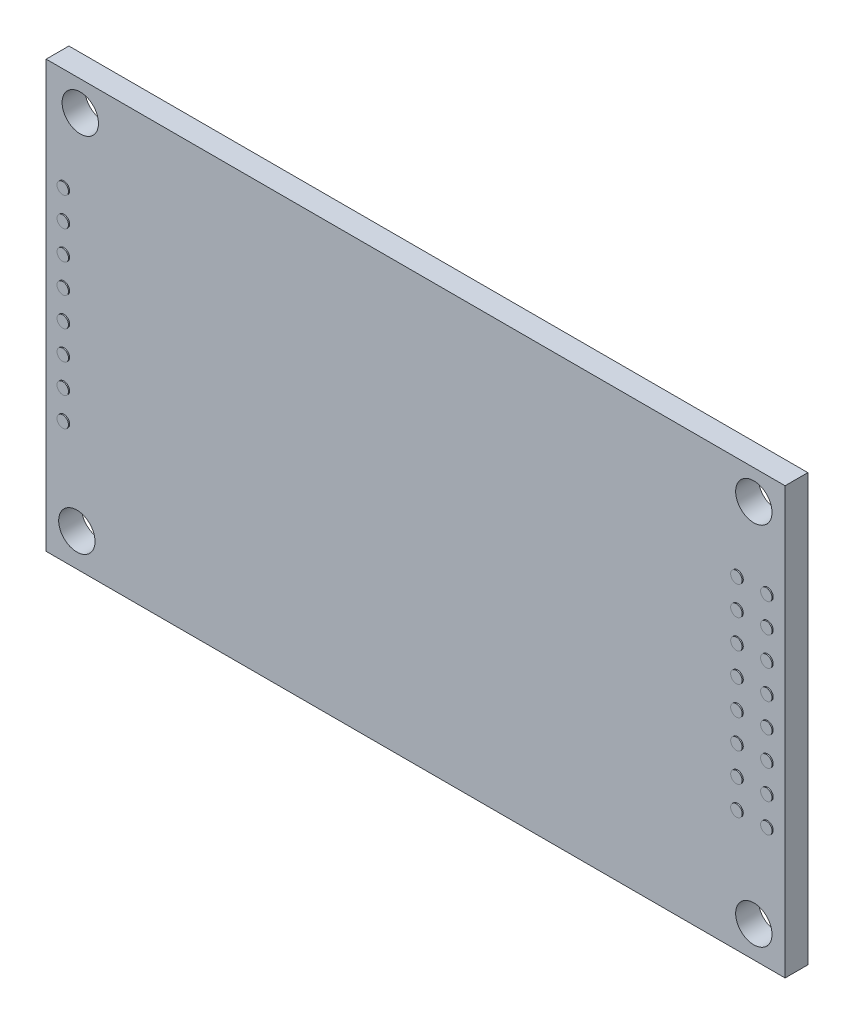
from build123d import *

# Parameters (mm, degrees)
SKETCH2_W               = 65
SKETCH2_H               = 37.5
SKETCH2_R               = 1.6
SKETCH2_R_2             = 0.201294772
BOSS_EXTRUDE1_DEPTH     = 2
SKETCH2_3_R             = 0.505
BOSS_EXTRUDE2_DEPTH     = 0.1
LPATTERN1_COUNT         = 8
LPATTERN1_PITCH         = 2.54
MIRROR1_COPY_1_SKETCH_R = 0.505
MIRROR1_COPY_1_DEPTH    = 0.1
MIRROR1_COPY_2_SKETCH_R = 0.505
MIRROR1_COPY_2_DEPTH    = 0.1
MIRROR1_COPY_3_SKETCH_R = 0.505
MIRROR1_COPY_3_DEPTH    = 0.1
MIRROR1_COPY_4_SKETCH_R = 0.505
MIRROR1_COPY_4_DEPTH    = 0.1
MIRROR1_COPY_5_SKETCH_R = 0.505
MIRROR1_COPY_5_DEPTH    = 0.1
MIRROR1_COPY_6_SKETCH_R = 0.505
MIRROR1_COPY_6_DEPTH    = 0.1
MIRROR1_COPY_7_SKETCH_R = 0.505
MIRROR1_COPY_7_DEPTH    = 0.1
MIRROR2_COPY_1_SKETCH_R = 0.505
MIRROR2_COPY_1_DEPTH    = 0.1
MIRROR2_COPY_2_SKETCH_R = 0.505
MIRROR2_COPY_2_DEPTH    = 0.1
MIRROR2_COPY_3_SKETCH_R = 0.505
MIRROR2_COPY_3_DEPTH    = 0.1
MIRROR2_COPY_4_SKETCH_R = 0.505
MIRROR2_COPY_4_DEPTH    = 0.1
MIRROR2_COPY_5_SKETCH_R = 0.505
MIRROR2_COPY_5_DEPTH    = 0.1
MIRROR2_COPY_6_SKETCH_R = 0.505
MIRROR2_COPY_6_DEPTH    = 0.1
MIRROR2_COPY_7_SKETCH_R = 0.505
MIRROR2_COPY_7_DEPTH    = 0.1


with BuildPart() as part:
    # Sketch2 → Boss-Extrude1 (new body)
    with BuildSketch(Plane.XY):
        with Locations((0.820647671, -17.581573661)):
            Rectangle(SKETCH2_W, SKETCH2_H)
        with Locations((-28.979352329, -33.431573661)):
            Circle(SKETCH2_R, mode=Mode.SUBTRACT)
        with Locations((30.570647671, -33.581573661)):
            Circle(SKETCH2_R, mode=Mode.SUBTRACT)
        with Locations((-28.679352329, -1.431573661)):
            Circle(SKETCH2_R, mode=Mode.SUBTRACT)
        with Locations((29.137165251, -7.831573661)):
            Circle(SKETCH2_R_2, mode=Mode.SUBTRACT)
        with Locations((30.570647671, -1.431573661)):
            Circle(SKETCH2_R, mode=Mode.SUBTRACT)
    extrude(amount=-BOSS_EXTRUDE1_DEPTH)

    # Sketch2<3> → Boss-Extrude2 (add)
    with BuildSketch(Plane.XY):
        with Locations((31.770647671, -7.831573661)):
            Circle(SKETCH2_3_R)
    boss_extrude2 = extrude(amount=BOSS_EXTRUDE2_DEPTH)

    # LPattern1: Boss-Extrude2 ×8
    with Locations(*[(0, -i * LPATTERN1_PITCH, 0) for i in range(1, LPATTERN1_COUNT)]):
        add(boss_extrude2)

    # Mirror1: Boss-Extrude2 across plane
    add(boss_extrude2.mirror(Plane(origin=(30.453906461, 0, 0), x_dir=(0, 0, 1), z_dir=(1, 0, 0))))

    # Mirror1 copy 1 sketch → Mirror1 copy 1 (add)
    with BuildSketch(Plane(origin=(60.907812922, -2.54, 0), x_dir=(-1, 0, 0), z_dir=(0, 0, 1))):
        with Locations((31.770647671, 7.831573661)):
            Circle(MIRROR1_COPY_1_SKETCH_R)
    extrude(amount=MIRROR1_COPY_1_DEPTH)

    # Mirror1 copy 2 sketch → Mirror1 copy 2 (add)
    with BuildSketch(Plane(origin=(60.907812922, -5.08, 0), x_dir=(-1, 0, 0), z_dir=(0, 0, 1))):
        with Locations((31.770647671, 7.831573661)):
            Circle(MIRROR1_COPY_2_SKETCH_R)
    extrude(amount=MIRROR1_COPY_2_DEPTH)

    # Mirror1 copy 3 sketch → Mirror1 copy 3 (add)
    with BuildSketch(Plane(origin=(60.907812922, -7.62, 0), x_dir=(-1, 0, 0), z_dir=(0, 0, 1))):
        with Locations((31.770647671, 7.831573661)):
            Circle(MIRROR1_COPY_3_SKETCH_R)
    extrude(amount=MIRROR1_COPY_3_DEPTH)

    # Mirror1 copy 4 sketch → Mirror1 copy 4 (add)
    with BuildSketch(Plane(origin=(60.907812922, -10.16, 0), x_dir=(-1, 0, 0), z_dir=(0, 0, 1))):
        with Locations((31.770647671, 7.831573661)):
            Circle(MIRROR1_COPY_4_SKETCH_R)
    extrude(amount=MIRROR1_COPY_4_DEPTH)

    # Mirror1 copy 5 sketch → Mirror1 copy 5 (add)
    with BuildSketch(Plane(origin=(60.907812922, -12.7, 0), x_dir=(-1, 0, 0), z_dir=(0, 0, 1))):
        with Locations((31.770647671, 7.831573661)):
            Circle(MIRROR1_COPY_5_SKETCH_R)
    extrude(amount=MIRROR1_COPY_5_DEPTH)

    # Mirror1 copy 6 sketch → Mirror1 copy 6 (add)
    with BuildSketch(Plane(origin=(60.907812922, -15.24, 0), x_dir=(-1, 0, 0), z_dir=(0, 0, 1))):
        with Locations((31.770647671, 7.831573661)):
            Circle(MIRROR1_COPY_6_SKETCH_R)
    extrude(amount=MIRROR1_COPY_6_DEPTH)

    # Mirror1 copy 7 sketch → Mirror1 copy 7 (add)
    with BuildSketch(Plane(origin=(60.907812922, -17.78, 0), x_dir=(-1, 0, 0), z_dir=(0, 0, 1))):
        with Locations((31.770647671, 7.831573661)):
            Circle(MIRROR1_COPY_7_SKETCH_R)
    extrude(amount=MIRROR1_COPY_7_DEPTH)

    # Mirror2: Boss-Extrude2 across plane
    add(boss_extrude2.mirror(Plane(origin=(0.82462639, 0, 0), x_dir=(0, 0, 1), z_dir=(1, 0, 0))))

    # Mirror2 copy 1 sketch → Mirror2 copy 1 (add)
    with BuildSketch(Plane(origin=(1.64925278, -2.54, 0), x_dir=(-1, 0, 0), z_dir=(0, 0, 1))):
        with Locations((31.770647671, 7.831573661)):
            Circle(MIRROR2_COPY_1_SKETCH_R)
    extrude(amount=MIRROR2_COPY_1_DEPTH)

    # Mirror2 copy 2 sketch → Mirror2 copy 2 (add)
    with BuildSketch(Plane(origin=(1.64925278, -5.08, 0), x_dir=(-1, 0, 0), z_dir=(0, 0, 1))):
        with Locations((31.770647671, 7.831573661)):
            Circle(MIRROR2_COPY_2_SKETCH_R)
    extrude(amount=MIRROR2_COPY_2_DEPTH)

    # Mirror2 copy 3 sketch → Mirror2 copy 3 (add)
    with BuildSketch(Plane(origin=(1.64925278, -7.62, 0), x_dir=(-1, 0, 0), z_dir=(0, 0, 1))):
        with Locations((31.770647671, 7.831573661)):
            Circle(MIRROR2_COPY_3_SKETCH_R)
    extrude(amount=MIRROR2_COPY_3_DEPTH)

    # Mirror2 copy 4 sketch → Mirror2 copy 4 (add)
    with BuildSketch(Plane(origin=(1.64925278, -10.16, 0), x_dir=(-1, 0, 0), z_dir=(0, 0, 1))):
        with Locations((31.770647671, 7.831573661)):
            Circle(MIRROR2_COPY_4_SKETCH_R)
    extrude(amount=MIRROR2_COPY_4_DEPTH)

    # Mirror2 copy 5 sketch → Mirror2 copy 5 (add)
    with BuildSketch(Plane(origin=(1.64925278, -12.7, 0), x_dir=(-1, 0, 0), z_dir=(0, 0, 1))):
        with Locations((31.770647671, 7.831573661)):
            Circle(MIRROR2_COPY_5_SKETCH_R)
    extrude(amount=MIRROR2_COPY_5_DEPTH)

    # Mirror2 copy 6 sketch → Mirror2 copy 6 (add)
    with BuildSketch(Plane(origin=(1.64925278, -15.24, 0), x_dir=(-1, 0, 0), z_dir=(0, 0, 1))):
        with Locations((31.770647671, 7.831573661)):
            Circle(MIRROR2_COPY_6_SKETCH_R)
    extrude(amount=MIRROR2_COPY_6_DEPTH)

    # Mirror2 copy 7 sketch → Mirror2 copy 7 (add)
    with BuildSketch(Plane(origin=(1.64925278, -17.78, 0), x_dir=(-1, 0, 0), z_dir=(0, 0, 1))):
        with Locations((31.770647671, 7.831573661)):
            Circle(MIRROR2_COPY_7_SKETCH_R)
    extrude(amount=MIRROR2_COPY_7_DEPTH)


solid = part.part
